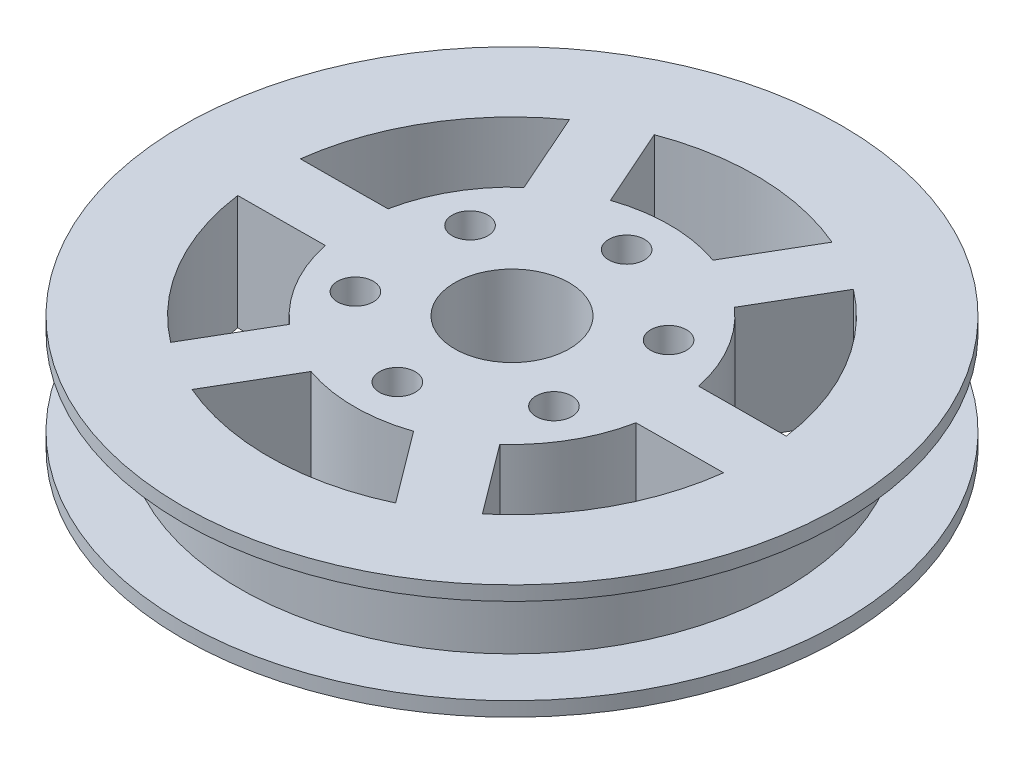
from build123d import *

# Parameters (mm, degrees)
SKETCH2_R               = 60.325
SKETCH2_R_2             = 3.96875
SKETCH2_R_3             = 12.7
BOSS_EXTRUDE1_DEPTH     = 19.05
SKETCH3_R               = 73.025
SKETCH3_R_2             = 3.96875
SKETCH3_R_3             = 12.7
BOSS_EXTRUDE2_DEPTH     = 3.175
BOSS_EXTRUDE3_START     = 3.175
SKETCH4_R               = 73.025
SKETCH4_R_2             = 12.7
SKETCH4_R_3             = 3.96875
BOSS_EXTRUDE3_DEPTH     = 3.175
CUT_EXTRUDE1_DEPTH      = 106.637360224
CUT_EXTRUDE1_DEPTH_BACK = 106.637360224


with BuildPart() as part:
    # Sketch2 → Boss-Extrude1 (new body)
    with BuildSketch(Plane(origin=(0, 0, 0), x_dir=(1, 0, 0), z_dir=(0, 1, 0))):
        with Locations(Location((0, 0, 0), (0, 0, 90))):
            Circle(SKETCH2_R)
        with Locations(Location((0, 25.4, 0), (0, 0, 90))):
            Circle(SKETCH2_R_2, mode=Mode.SUBTRACT)
        with Locations(Location((21.997045256, 12.7, 0), (0, 0, 90))):
            Circle(SKETCH2_R_2, mode=Mode.SUBTRACT)
        with Locations(Location((21.997045256, -12.7, 0), (0, 0, 90))):
            Circle(SKETCH2_R_2, mode=Mode.SUBTRACT)
        with Locations(Location((0, -25.4, 0), (0, 0, 90))):
            Circle(SKETCH2_R_2, mode=Mode.SUBTRACT)
        with Locations(Location((-21.997045256, -12.7, 0), (0, 0, 90))):
            Circle(SKETCH2_R_2, mode=Mode.SUBTRACT)
        with Locations(Location((-21.997045256, 12.7, 0), (0, 0, 90))):
            Circle(SKETCH2_R_2, mode=Mode.SUBTRACT)
        with Locations(Location((0, 0, 0), (0, 0, 90))):
            Circle(SKETCH2_R_3, mode=Mode.SUBTRACT)
    extrude(amount=BOSS_EXTRUDE1_DEPTH)

    # Sketch3 → Boss-Extrude2 (add)
    with BuildSketch(Plane(origin=(0, 19.05, 0), x_dir=(1, 0, 0), z_dir=(0, 1, 0))):
        with Locations(Location((0, 0, 0), (0, 0, 270))):
            Circle(SKETCH3_R)
        with Locations(Location((0, 25.4, 0), (0, 0, 90))):
            Circle(SKETCH3_R_2, mode=Mode.SUBTRACT)
        with Locations(Location((21.997045256, 12.7, 0), (0, 0, 90))):
            Circle(SKETCH3_R_2, mode=Mode.SUBTRACT)
        with Locations(Location((21.997045256, -12.7, 0), (0, 0, 90))):
            Circle(SKETCH3_R_2, mode=Mode.SUBTRACT)
        with Locations(Location((0, -25.4, 0), (0, 0, 90))):
            Circle(SKETCH3_R_2, mode=Mode.SUBTRACT)
        with Locations(Location((-21.997045256, -12.7, 0), (0, 0, 90))):
            Circle(SKETCH3_R_2, mode=Mode.SUBTRACT)
        with Locations(Location((0, 0, 0), (0, 0, 90))):
            Circle(SKETCH3_R_3, mode=Mode.SUBTRACT)
        with Locations(Location((-21.997045256, 12.7, 0), (0, 0, 90))):
            Circle(SKETCH3_R_2, mode=Mode.SUBTRACT)
    extrude(amount=BOSS_EXTRUDE2_DEPTH)

    # Sketch4 → Boss-Extrude3 (add)
    with BuildSketch(Plane.XZ.offset(BOSS_EXTRUDE3_START)):
        with Locations(Location((0, 0, 0), (0, 0, 90))):
            Circle(SKETCH4_R)
        with Locations(Location((0, 0, 0), (0, 0, 270))):
            Circle(SKETCH4_R_2, mode=Mode.SUBTRACT)
        with Locations(Location((-21.997045256, -12.7, 0), (0, 0, 270))):
            Circle(SKETCH4_R_3, mode=Mode.SUBTRACT)
        with Locations(Location((0, -25.4, 0), (0, 0, 270))):
            Circle(SKETCH4_R_3, mode=Mode.SUBTRACT)
        with Locations(Location((21.997045256, -12.7, 0), (0, 0, 270))):
            Circle(SKETCH4_R_3, mode=Mode.SUBTRACT)
        with Locations(Location((21.997045256, 12.7, 0), (0, 0, 270))):
            Circle(SKETCH4_R_3, mode=Mode.SUBTRACT)
        with Locations(Location((0, 25.4, 0), (0, 0, 270))):
            Circle(SKETCH4_R_3, mode=Mode.SUBTRACT)
        with Locations(Location((-21.997045256, 12.7, 0), (0, 0, 270))):
            Circle(SKETCH4_R_3, mode=Mode.SUBTRACT)
    extrude(amount=-BOSS_EXTRUDE3_DEPTH)

    # Sketch6 → Cut-Extrude1 (cut, two sides: drawn at the far end of the back side and taken through both)
    with BuildSketch(Plane(origin=(0, 0, 0), x_dir=(1, 0, 0), z_dir=(0, 1, 0)).offset(-CUT_EXTRUDE1_DEPTH_BACK)):
        with BuildLine():
            ThreePointArc((21.314275493, 49.588328115), (1.249191015, 53.960542499), (-18.996723984, 50.521531082))
            Line((-18.996723984, 50.521531082), (-11.255118383, 33.061729162))
            ThreePointArc((-11.255118383, 33.061729162), (0.178151467, 34.924545624), (11.591822226, 32.945186029))
            Line((11.591822226, 32.945186029), (21.314275493, 49.588328115))
        make_face()
        with BuildLine():
            ThreePointArc((-31.283856312, 43.984326291), (-46.343943604, 27.668384778), (-53.561272173, 6.670138541))
            Line((-53.561272173, 6.670138541), (-34.259856576, 6.783645952))
            ThreePointArc((-34.259856576, 6.783645952), (-30.348105608, 17.284331372), (-23.312207546, 26.005703304))
            Line((-23.312207546, 26.005703304), (-31.283856312, 43.984326291))
        make_face()
        with BuildLine():
            ThreePointArc((-53.47911905, -7.299619899), (-46.638038937, -27.169724863), (-32.727191245, -42.921225264))
            Line((-32.727191245, -42.921225264), (-23.004737979, -26.278083178))
            ThreePointArc((-23.004737979, -26.278083178), (-30.1427228, -17.640064829), (-34.177703438, -7.186112487))
            Line((-34.177703438, -7.186112487), (-53.47911905, -7.299619899))
        make_face()
        with BuildLine():
            Line((-11.591822226, -32.945186029), (-21.314275493, -49.588328115))
            ThreePointArc((-21.314275493, -49.588328115), (0.938377322, -53.966842348), (23.025356811, -48.817349054))
            Line((23.025356811, -48.817349054), (11.255118563, -33.061729101))
            ThreePointArc((11.255118563, -33.061729101), (-0.178151371, -34.924545625), (-11.591822226, -32.945186029))
        make_face()
        with BuildLine():
            Line((23.312207688, -26.005703177), (34.742784352, -41.306652739))
            ThreePointArc((34.742784352, -41.306652739), (47.427034742, -25.767751175), (53.56127215, -6.670138728))
            Line((53.56127215, -6.670138728), (34.259856539, -6.783646139))
            ThreePointArc((34.259856539, -6.783646139), (30.348105608, -17.284331372), (23.312207688, -26.005703177))
        make_face()
        with BuildLine():
            Line((34.177703478, 7.186112301), (53.479119075, 7.299619712))
            ThreePointArc((53.479119075, 7.299619712), (46.638038984, 27.169724781), (32.727191245, 42.921225264))
            Line((32.727191245, 42.921225264), (23.004737979, 26.278083178))
            ThreePointArc((23.004737979, 26.278083178), (30.142722848, 17.640064747), (34.177703478, 7.186112301))
        make_face()
    extrude(amount=CUT_EXTRUDE1_DEPTH + CUT_EXTRUDE1_DEPTH_BACK, mode=Mode.SUBTRACT)


solid = part.part
